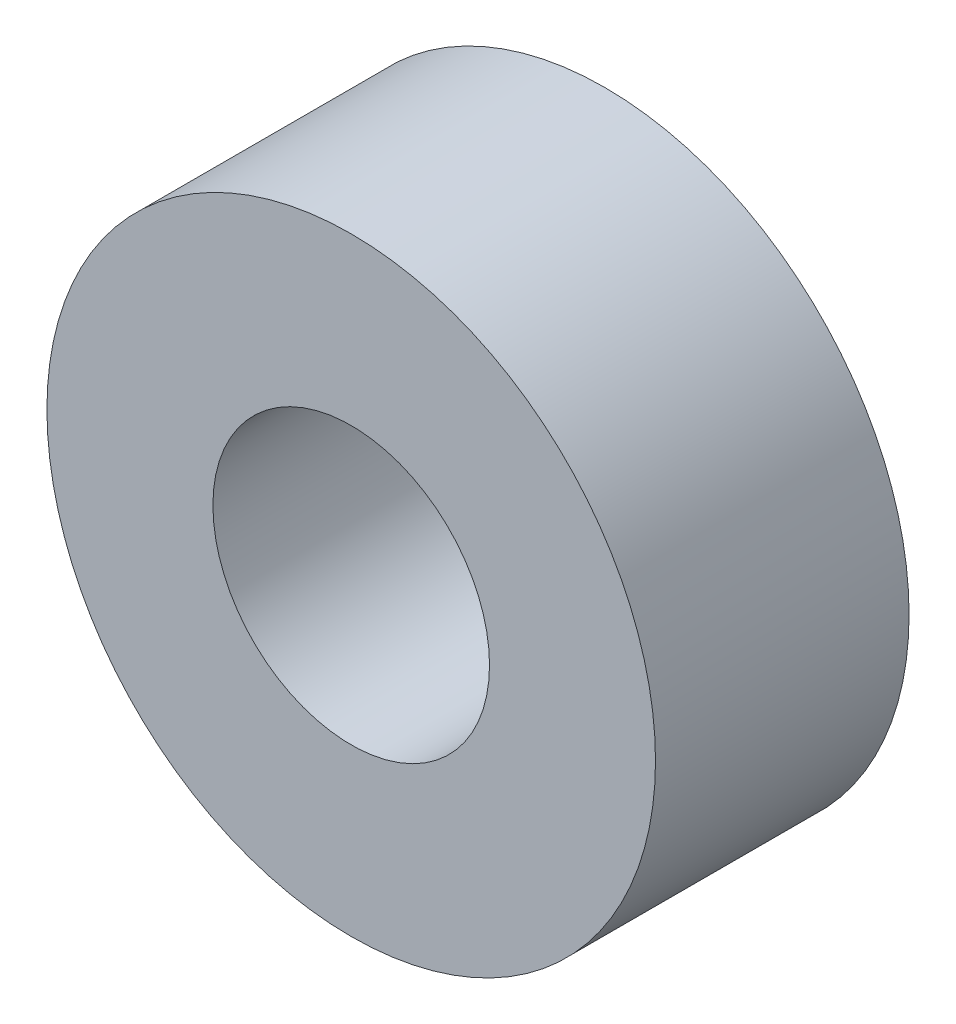
from build123d import *

# Parameters (mm, degrees)
SKETCH1_R           = 3.3
SKETCH1_R_2         = 1.5
BOSS_EXTRUDE1_DEPTH = 1.375


with BuildPart() as part:
    # Sketch1 → Boss-Extrude1 (new, symmetric)
    with BuildSketch(Plane.XY):
        Circle(SKETCH1_R)
        Circle(SKETCH1_R_2, mode=Mode.SUBTRACT)
    extrude(amount=BOSS_EXTRUDE1_DEPTH, both=True)


solid = part.part
